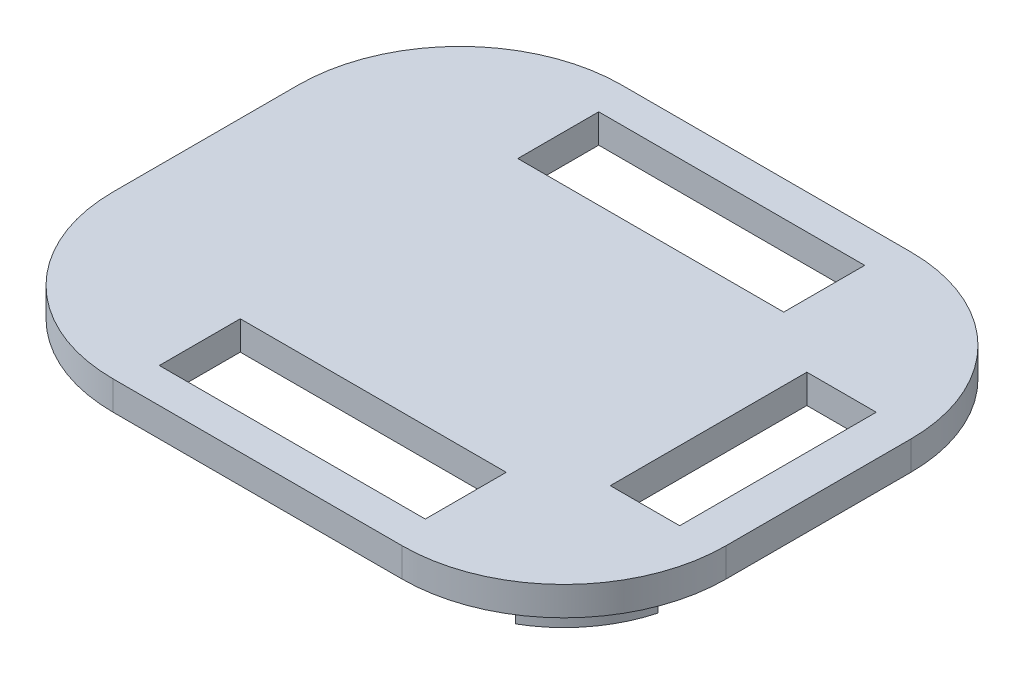
from build123d import *

# Parameters (mm, degrees)
SKETCH1_W           = 23
SKETCH1_H           = 7
SKETCH1_W_2         = 6
SKETCH1_H_2         = 17
BOSS_EXTRUDE1_DEPTH = 2.5
BOSS_EXTRUDE2_DEPTH = 2.5


with BuildPart() as part:
    # Sketch1 → Boss-Extrude1 (new body)
    with BuildSketch(Plane(origin=(0, 0, 0), x_dir=(1, 0, 0), z_dir=(0, 1, 0))):
        with BuildLine():
            Line((-26.5, 8), (-26.5, -8))
            ThreePointArc((-26.5, -8), (-22.399494937, -17.899494937), (-12.5, -22))
            Line((-12.5, -22), (12.5, -22))
            ThreePointArc((12.5, -22), (22.399494937, -17.899494937), (26.5, -8))
            Line((26.5, -8), (26.5, 8))
            ThreePointArc((26.5, 8), (22.399494937, 17.899494937), (12.5, 22))
            Line((12.5, 22), (-12.5, 22))
            ThreePointArc((-12.5, 22), (-22.399494937, 17.899494937), (-26.5, 8))
        make_face()
        with Locations((0, -15.5)):
            Rectangle(SKETCH1_W, SKETCH1_H, mode=Mode.SUBTRACT)
        with Locations((20, 0)):
            Rectangle(SKETCH1_W_2, SKETCH1_H_2, mode=Mode.SUBTRACT)
        with Locations((0, 15.5)):
            Rectangle(SKETCH1_W, SKETCH1_H, mode=Mode.SUBTRACT)
    extrude(amount=BOSS_EXTRUDE1_DEPTH)

    # Sketch2 → Boss-Extrude2 (add)
    with BuildSketch(Plane.XZ):
        with BuildLine():
            Line((-17, 15.794228634), (-18.25, 17.959292144))
            ThreePointArc((-18.25, 17.959292144), (-21.623563413, 15.000756434), (-23.608147002, 10.976419019))
            Line((-23.608147002, 10.976419019), (-21.193332437, 10.329371406))
            ThreePointArc((-21.193332437, 10.329371406), (-19.640180063, 13.478852861), (-17, 15.794228634))
        make_face()
        with BuildLine():
            Line((23.608147002, 10.976419019), (21.193332437, 10.329371406))
            ThreePointArc((21.193332437, 10.329371406), (19.640180063, 13.478852861), (17, 15.794228634))
            Line((17, 15.794228634), (18.25, 17.959292144))
            ThreePointArc((18.25, 17.959292144), (21.623563413, 15.000756434), (23.608147002, 10.976419019))
        make_face()
        with BuildLine():
            Line((17, -15.794228634), (18.25, -17.959292144))
            ThreePointArc((18.25, -17.959292144), (21.623563413, -15.000756434), (23.608147002, -10.976419019))
            Line((23.608147002, -10.976419019), (21.193332437, -10.329371406))
            ThreePointArc((21.193332437, -10.329371406), (19.640180063, -13.478852861), (17, -15.794228634))
        make_face()
        with BuildLine():
            Line((-23.608147002, -10.976419019), (-21.193332437, -10.329371406))
            ThreePointArc((-21.193332437, -10.329371406), (-19.640180063, -13.478852861), (-17, -15.794228634))
            Line((-17, -15.794228634), (-18.25, -17.959292144))
            ThreePointArc((-18.25, -17.959292144), (-21.623563413, -15.000756434), (-23.608147002, -10.976419019))
        make_face()
    extrude(amount=BOSS_EXTRUDE2_DEPTH)


solid = part.part
